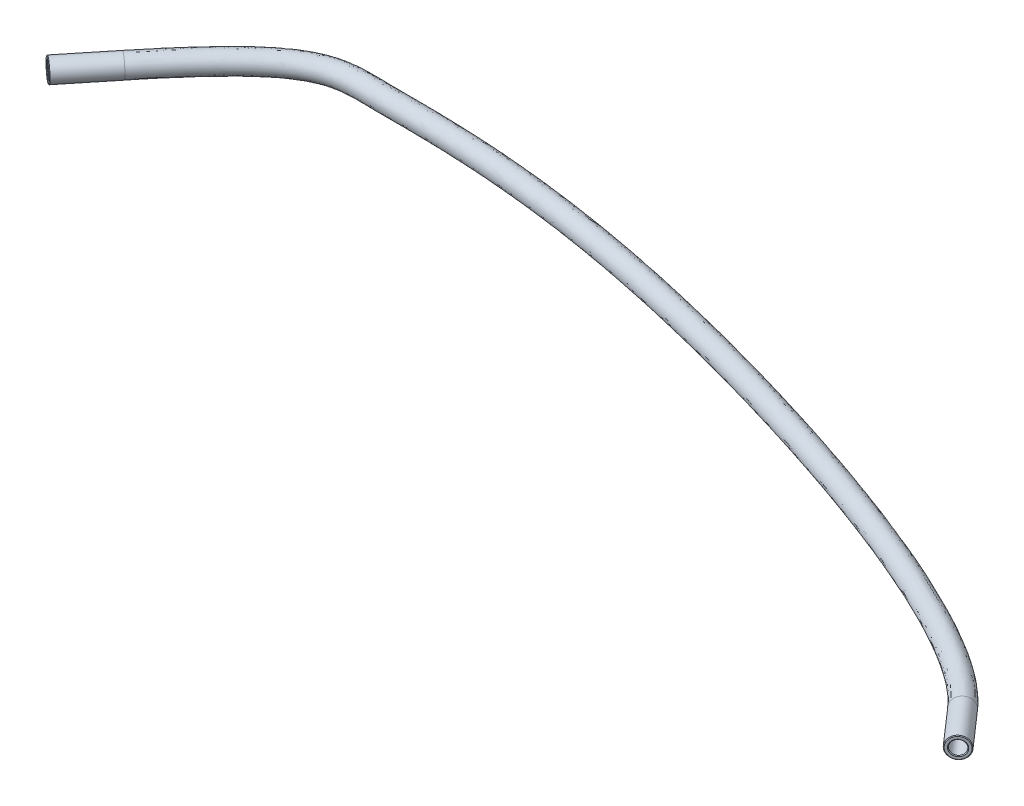
from build123d import *

# Parameters (mm, degrees)
SKETCH1_R     = 2
SKETCH1_R_2   = 1.3
CHAMFER1_SIZE = 0.127


with BuildPart() as part:
    # Sweep1: sweep along a curve in space
    with BuildLine() as sweep1_path:
        Line((-109.912579053, -99.5875, -21.924919528), (-116.326440239, -99.5875, -13.993817165))
        add(Edge.make_bspline(
            [(74.604127149, -99.6875, 3.918591429), (62.804964038, -99.6875, -9.55808219), (-32.990002224, -99.652202026, -42.829060997), (-83.325443001, -99.602202026, -40.268452954), (-93.662583417, -99.5875, -42.018958832), (-109.912579053, -99.5875, -21.924919528)],
            knots=[0, 0, 0, 0, 0.304238485, 0.705959482, 1, 1, 1, 1], degree=3))
        Line((80.664427015, -99.6875, 10.84049619), (74.604127149, -99.6875, 3.918591429))
    # Sketch1 → Sweep1 (sweep)
    with BuildSketch(Plane(origin=(35.697879774, 0, 40.773118402), x_dir=(-0.7523809523809661, 0, 0.6587282463158162), z_dir=(-0.6587282463158162, 0, -0.7523809523809661))):
        with Locations((-53.549437376, -99.6875)):
            Circle(SKETCH1_R)
        with Locations((-53.549437376, -99.6875)):
            Circle(SKETCH1_R_2, mode=Mode.SUBTRACT)
    sweep(path=sweep1_path.line)

    # Chamfer1
    chamfer1_edges = [part.edges().sort_by_distance(p)[0] for p in [
        (81.642522253, -99.6875, 9.98414947),
        (-117.337266625, -99.58636399, -14.81126975),
        (82.169188919, -99.6875, 9.523039698),
        (-117.881557756, -99.585752292, -15.251436526),
    ]]
    chamfer(chamfer1_edges, length=CHAMFER1_SIZE)


solid = part.part
